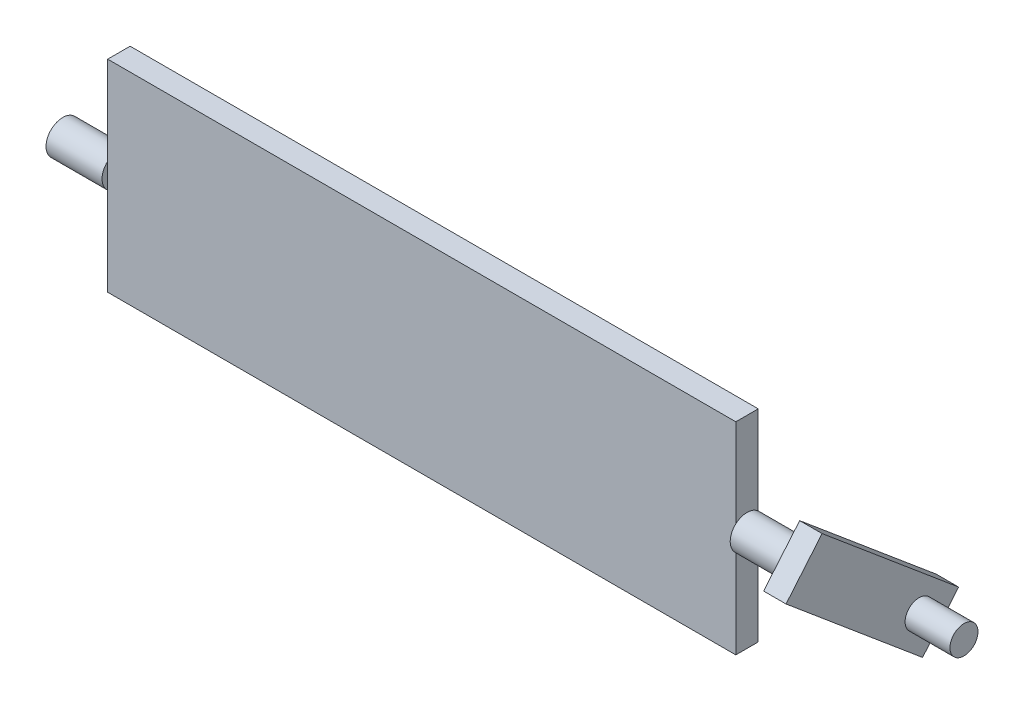
from build123d import *

# Parameters (mm, degrees)
SKETCH1_W           = 56
SKETCH1_H           = 18
LOUVER_FLAP_DEPTH   = 1
SKETCH2_R           = 1.5
PIVOT_SHAFT_L_DEPTH = 5
PIVOT_SHAFT_R_START = 5
SKETCH3_R           = 1.5
PIVOT_SHAFT_R_DEPTH = 5
CRANK_ARM_DEPTH     = 2
SKETCH5_R           = 1.25
CRANK_PIN_DEPTH     = 4


with BuildPart() as part:
    # Sketch1 → Louver_Flap (new, symmetric)
    with BuildSketch(Plane.XY):
        Rectangle(SKETCH1_W, SKETCH1_H)
    extrude(amount=LOUVER_FLAP_DEPTH, both=True)

    # Sketch2 → Pivot_Shaft_L (add)
    with BuildSketch(Plane.ZY.offset(28)):
        with Locations(Location((0, 0, 0), (0, 0, 131.810314896))):
            Circle(SKETCH2_R)
    extrude(amount=PIVOT_SHAFT_L_DEPTH)

    # Sketch3 → Pivot_Shaft_R (add)
    with BuildSketch(Plane(origin=(28, 0, 0), x_dir=(0, 0, -1), z_dir=(1, 0, 0)).offset(PIVOT_SHAFT_R_START)):
        with Locations(Location((0, 0, 0), (0, 0, 48.189685104))):
            Circle(SKETCH3_R)
    extrude(amount=-PIVOT_SHAFT_R_DEPTH)

    # Sketch4 → Crank_Arm (add)
    with BuildSketch(Plane(origin=(33, 0, 0), x_dir=(0, 0, -1), z_dir=(1, 0, 0))):
        Polygon((-3.522080132, -0.308142084), (8.650417232, -10.522080132), (11.86435528, -6.691857916), (-0.308142084, 3.522080132), align=None)
    extrude(amount=CRANK_ARM_DEPTH)

    # Sketch5 → Crank_Pin (add)
    with BuildSketch(Plane(origin=(35, 0, 0), x_dir=(0, 0, -1), z_dir=(1, 0, 0))):
        with Locations((8.342275148, -7)):
            Circle(SKETCH5_R)
    extrude(amount=CRANK_PIN_DEPTH)


solid = part.part
